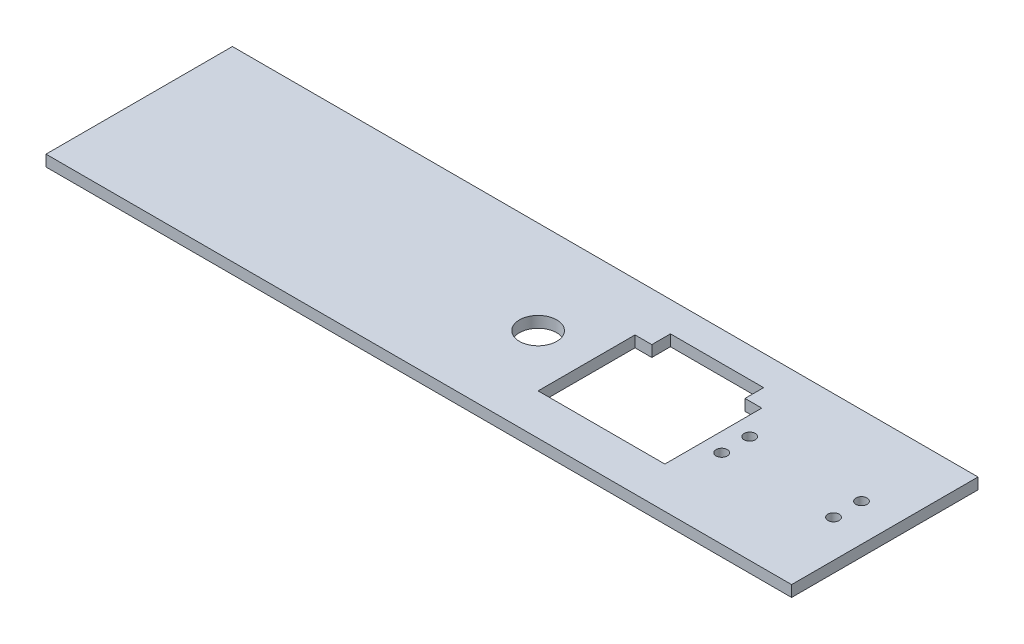
from build123d import *

# Parameters (mm, degrees)
SKETCH1_W               = 200
SKETCH1_H               = 50
BOSS_EXTRUDE1_DEPTH     = 1.5
SKETCH3_R               = 5
CUT_EXTRUDE2_DEPTH      = 108.976849371
CUT_EXTRUDE3_DEPTH      = 108.976849371
CUT_EXTRUDE3_DEPTH_BACK = 108.976849371
SKETCH4_R               = 1.5
CUT_EXTRUDE4_DEPTH      = 108.976849371
CUT_EXTRUDE4_DEPTH_BACK = 108.976849371
SKETCH5_W               = 34
SKETCH5_H               = 26
CUT_EXTRUDE5_DEPTH      = 108.976849371
CUT_EXTRUDE5_DEPTH_BACK = 108.976849371
SKETCH6_W               = 25
SKETCH6_H               = 5


with BuildPart() as part:
    # Sketch1 → Boss-Extrude1 (new, symmetric)
    with BuildSketch(Plane(origin=(0, 0, 0), x_dir=(1, 0, 0), z_dir=(0, 1, 0))):
        with Locations((5, 0)):
            Rectangle(SKETCH1_W, SKETCH1_H)
    extrude(amount=BOSS_EXTRUDE1_DEPTH, both=True)

    # Sketch3 → Cut-Extrude2 (cut, through all)
    with BuildSketch(Plane(origin=(0, 1.5, 0), x_dir=(1, 0, 0), z_dir=(0, 1, 0))):
        with Locations(Location((12, 0, 0), (0, 0, 270))):
            Circle(SKETCH3_R)
    extrude(amount=-CUT_EXTRUDE2_DEPTH, mode=Mode.SUBTRACT)

    # Sketch4 → Cut-Extrude3 (cut, two sides: drawn at the far end of the back side and taken through both)
    with BuildSketch(Plane(origin=(0, 1.5, 0), x_dir=(1, 0, 0), z_dir=(0, 1, 0)).offset(-CUT_EXTRUDE3_DEPTH_BACK)):
        with Locations(Location((65, 3.75, 0), (0, 0, 270))):
            Circle(SKETCH4_R)
        with Locations(Location((95, 3.75, 0), (0, 0, 270))):
            Circle(SKETCH4_R)
        with Locations(Location((95, -3.75, 0), (0, 0, 90))):
            Circle(SKETCH4_R)
        with Locations(Location((65, -3.75, 0), (0, 0, 90))):
            Circle(SKETCH4_R)
    extrude(amount=CUT_EXTRUDE3_DEPTH + CUT_EXTRUDE3_DEPTH_BACK, mode=Mode.SUBTRACT)

    # Sketch5 → Cut-Extrude4 (cut, two sides: drawn at the far end of the back side and taken through both)
    with BuildSketch(Plane(origin=(0, 1.5, 0), x_dir=(1, 0, 0), z_dir=(0, 1, 0)).offset(-CUT_EXTRUDE4_DEPTH_BACK)):
        with Locations((43, -1)):
            Rectangle(SKETCH5_W, SKETCH5_H)
    extrude(amount=CUT_EXTRUDE4_DEPTH + CUT_EXTRUDE4_DEPTH_BACK, mode=Mode.SUBTRACT)

    # Sketch6 → Cut-Extrude5 (cut, two sides: drawn at the far end of the back side and taken through both)
    with BuildSketch(Plane(origin=(0, 1.5, 0), x_dir=(1, 0, 0), z_dir=(0, 1, 0)).offset(-CUT_EXTRUDE5_DEPTH_BACK)):
        with Locations((43, 14.5)):
            Rectangle(SKETCH6_W, SKETCH6_H)
    extrude(amount=CUT_EXTRUDE5_DEPTH + CUT_EXTRUDE5_DEPTH_BACK, mode=Mode.SUBTRACT)


solid = part.part
